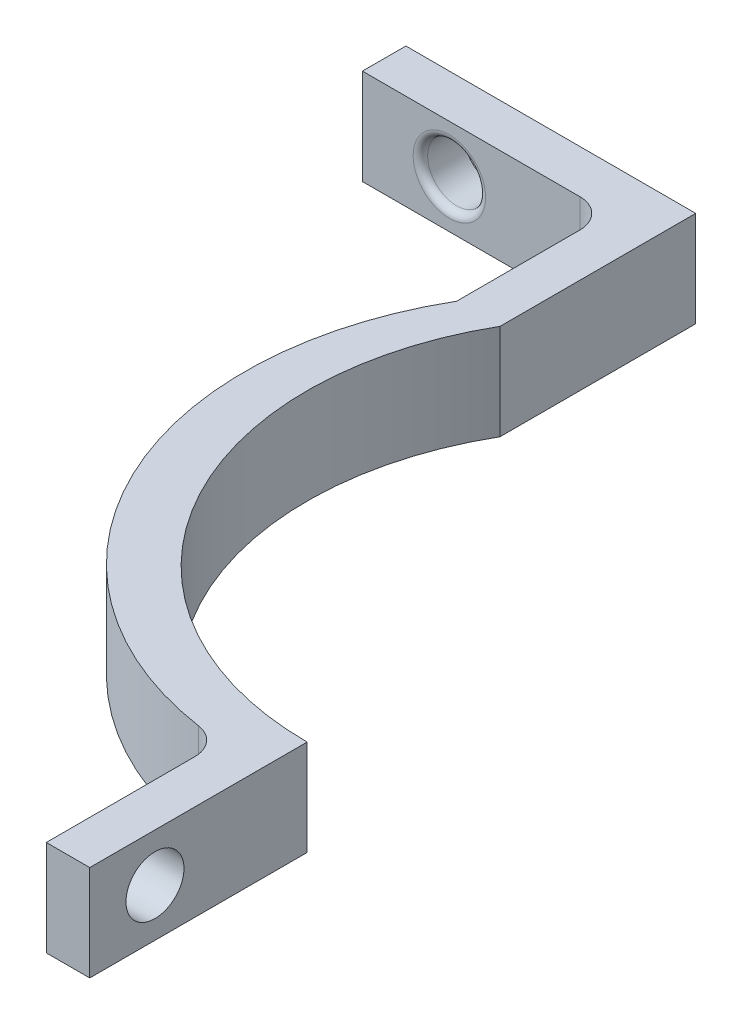
from build123d import *

# Parameters (mm, degrees)
BOSS_EXTRUDE1_DEPTH = 6.6
SKETCH4_R           = 2
CUT_EXTRUDE1_DEPTH  = 6.6
FILLET1_R           = 2
FILLET2_R           = 0.5
FILLET3_R           = 2
SKETCH5_R           = 2
CUT_EXTRUDE2_DEPTH  = 6.6


with BuildPart() as part:
    # Sketch3 → Boss-Extrude1 (new body)
    with BuildSketch(Plane(origin=(0, 0, 0), x_dir=(1, 0, 0), z_dir=(0, 1, 0))):
        with BuildLine():
            ThreePointArc((-18.186533479, 31.5), (-18.186533479, 10.5), (0, 0))
            Line((0, 0), (0, -3))
            ThreePointArc((0, -3), (-20.888208397, 7.927851418), (-21.186533479, 31.5))
            Line((-21.186533479, 31.5), (-18.186533479, 31.5))
        make_face()
        Polygon((-38.186533479, 42), (-21.186533479, 42), (-21.186533479, 31.5), (-18.186533479, 31.5), (-18.186533479, 45), (-38.186533479, 45), align=None)
        with BuildLine():
            Line((0, -15), (0, -3))
            ThreePointArc((0, -3), (-1.5004505, -3.035167191), (-3, -2.972399899))
            Line((-3, -2.972399899), (-3, -15))
            Line((-3, -15), (0, -15))
        make_face()
    extrude(amount=BOSS_EXTRUDE1_DEPTH)

    # Sketch4 → Cut-Extrude1 (cut)
    with BuildSketch(Plane.XY.offset(-42)):
        with Locations((-32.186533479, 3.3)):
            Circle(SKETCH4_R)
    extrude(amount=-CUT_EXTRUDE1_DEPTH, mode=Mode.SUBTRACT)

    # Fillet1
    fillet1_edges = [part.edges().sort_by_distance(p)[0] for p in [
        (-21.186533479, 3.3, -42),
    ]]
    fillet(fillet1_edges, radius=FILLET1_R)

    # Fillet2
    fillet2_edges = [part.edges().sort_by_distance(p)[0] for p in [
        (-34.186533479, 3.3, -42),
    ]]
    fillet(fillet2_edges, radius=FILLET2_R)

    # Fillet3
    fillet3_edges = [part.edges().sort_by_distance(p)[0] for p in [
        (-3, 3.3, 2.972399899),
    ]]
    fillet(fillet3_edges, radius=FILLET3_R)

    # Sketch5 → Cut-Extrude2 (cut)
    with BuildSketch(Plane.ZY.offset(3)):
        with Locations((10.5, 3.3)):
            Circle(SKETCH5_R)
    extrude(amount=-CUT_EXTRUDE2_DEPTH, mode=Mode.SUBTRACT)


solid = part.part
